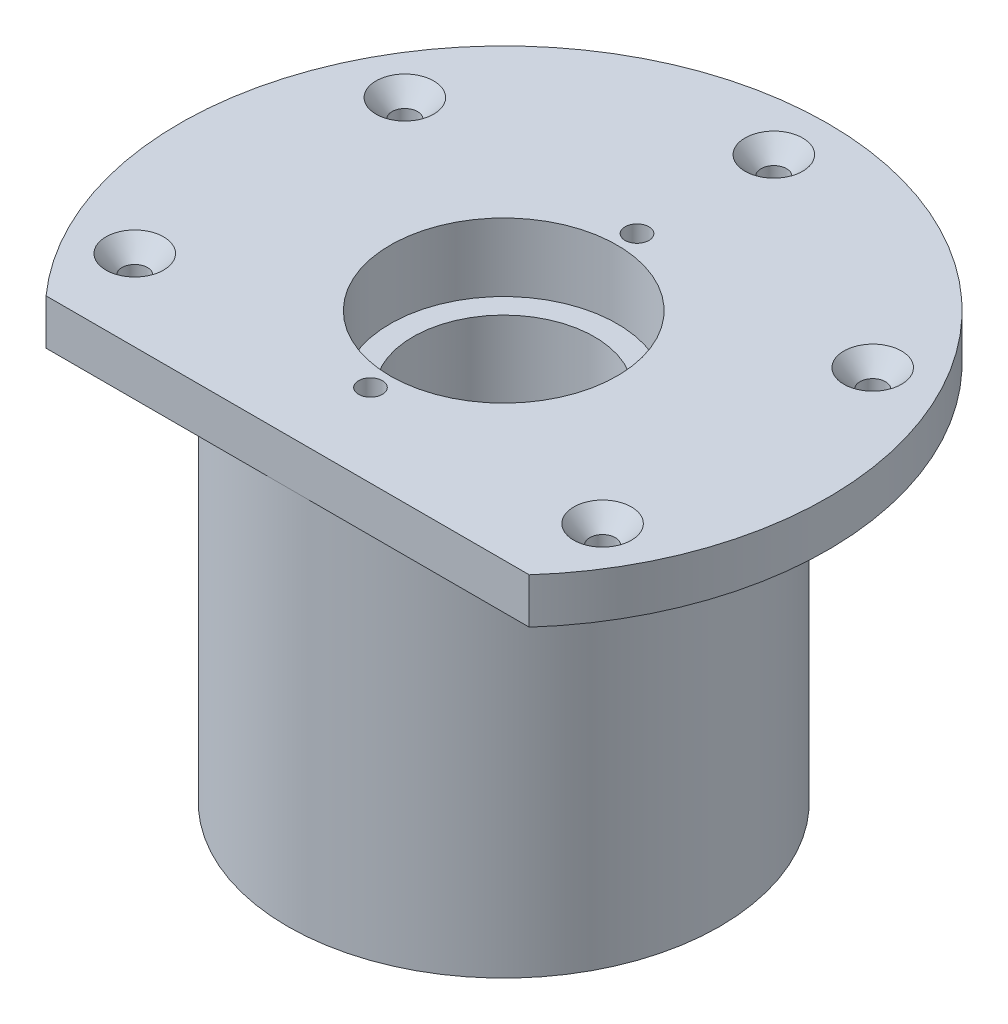
from build123d import *

# Parameters (mm, degrees)
SKETCH1_R                                      = 38.1
SKETCH1_R_2                                    = 20
BOSS_EXTRUDE1_DEPTH                            = 75
BOSS_EXTRUDE2_START                            = -8
SKETCH2_R                                      = 38.1
SKETCH2_R_2                                    = 20
BOSS_EXTRUDE2_DEPTH                            = 8
CSK_FOR_8_FLAT_HEAD_MACHINE_SCREW2_D           = 4.4958
CSK_FOR_8_FLAT_HEAD_MACHINE_SCREW2_CSINK_D     = 10.1713792
CSK_FOR_8_FLAT_HEAD_MACHINE_SCREW2_CSINK_ANGLE = 82
BOSS_EXTRUDE3_START                            = -63
SKETCH5_R                                      = 20
SKETCH5_R_2                                    = 16
BOSS_EXTRUDE3_DEPTH                            = 51
TAP_DRILL_FOR_M5X0_8_TAP1_D                    = 4.2


with BuildPart() as part:
    # Sketch1 → Boss-Extrude1 (new body)
    with BuildSketch(Plane(origin=(0, 0, 0), x_dir=(1, 0, 0), z_dir=(0, 1, 0))):
        with Locations(Location((0, 0, 0), (0, 0, 270))):
            Circle(SKETCH1_R)
        with Locations(Location((0, 0, 0), (0, 0, 270))):
            Circle(SKETCH1_R_2, mode=Mode.SUBTRACT)
    extrude(amount=BOSS_EXTRUDE1_DEPTH)

    # Sketch2 → Boss-Extrude2 (add)
    # profile 1 of 2: a face of its own
    with BuildSketch(Plane(origin=(0, 75, 0), x_dir=(1, 0, 0), z_dir=(0, 1, 0)).offset(BOSS_EXTRUDE2_START)):
        with BuildLine():
            ThreePointArc((57.15, 0), (-20.392382431, 53.387950315), (-42.597094971, -38.1))
            Line((-42.597094971, -38.1), (0, -38.1))
            Line((0, -38.1), (42.597094971, -38.1))
            ThreePointArc((42.597094971, -38.1), (53.387950315, -20.392382431), (57.15, 0))
        make_face()
        with BuildLine():
            ThreePointArc((38.1, 0), (26.940768363, -26.940768363), (0, -38.1))
            ThreePointArc((0, -38.1), (-26.940768363, 26.940768363), (38.1, 0))
        make_face(mode=Mode.SUBTRACT)
    # profile 2 of 2: a face of its own
    with BuildSketch(Plane(origin=(0, 75, 0), x_dir=(1, 0, 0), z_dir=(0, 1, 0)).offset(BOSS_EXTRUDE2_START)):
        with Locations(Location((0, 0, 0), (0, 0, 270))):
            Circle(SKETCH2_R)
        with Locations(Location((0, 0, 0), (0, 0, 270))):
            Circle(SKETCH2_R_2, mode=Mode.SUBTRACT)
    extrude(amount=BOSS_EXTRUDE2_DEPTH)

    # CSK for #8 Flat Head Machine Screw2 (through all)
    with Locations(Plane(origin=(0, 75, 0), x_dir=(1, 0, 0), z_dir=(0, 1, 0))):
        with Locations((-41.244459855, -23.8125), (-41.244459855, 23.8125), (0, 47.625), (41.244459855, 23.8125), (41.244459855, -23.8125), (0, -47.625)):
            CounterSinkHole(CSK_FOR_8_FLAT_HEAD_MACHINE_SCREW2_D / 2, CSK_FOR_8_FLAT_HEAD_MACHINE_SCREW2_CSINK_D / 2, counter_sink_angle=CSK_FOR_8_FLAT_HEAD_MACHINE_SCREW2_CSINK_ANGLE)

    # Sketch5 → Boss-Extrude3 (add)
    with BuildSketch(Plane(origin=(0, 75, 0), x_dir=(1, 0, 0), z_dir=(0, 1, 0)).offset(BOSS_EXTRUDE3_START)):
        with Locations(Location((0, 0, 0), (0, 0, 270))):
            Circle(SKETCH5_R)
        with Locations(Location((0, 0, 0), (0, 0, 270))):
            Circle(SKETCH5_R_2, mode=Mode.SUBTRACT)
    extrude(amount=BOSS_EXTRUDE3_DEPTH)

    # Tap Drill for M5x0.8 Tap1 (through all)
    with Locations(Plane(origin=(0, 75, 0), x_dir=(1, 0, 0), z_dir=(0, 1, 0))):
        with Locations((0, 23.5), (0, -23.5)):
            Hole(TAP_DRILL_FOR_M5X0_8_TAP1_D / 2)


solid = part.part
